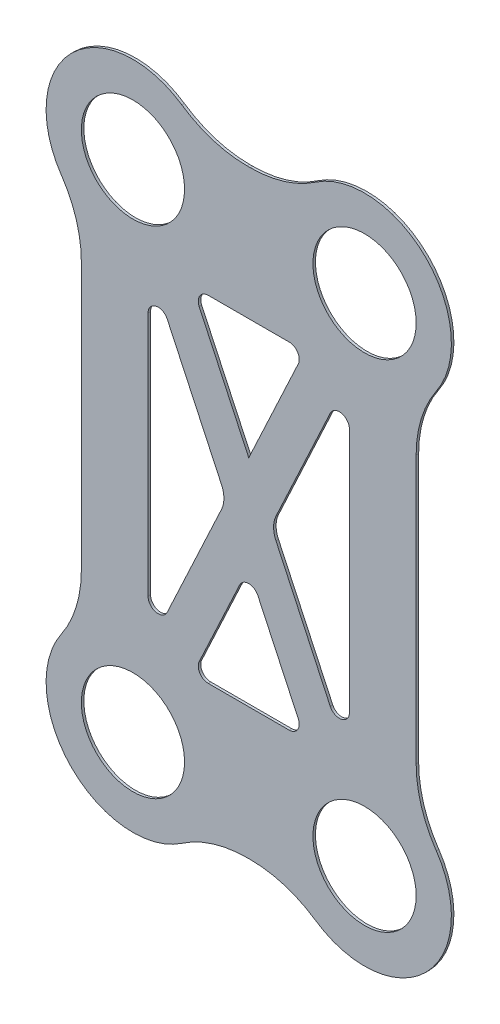
from build123d import *

# Parameters (mm, degrees)
SKETCH_1_R          = 10.25
EXTRUDE_2_DEPTH     = 0.5
FILLET_1_R          = 23
CUT_EXTRUDE_1_DEPTH = 55
FILLET_2_R          = 2
FILLET_3_R          = 5


with BuildPart() as part:
    # 草图1 → 凸台-拉伸2 (new body)
    with BuildSketch(Plane.XY):
        with BuildLine():
            ThreePointArc((-9.125563074, 59.5), (-35.197591975, 61.447591975), (-33.25, 35.375563074))
            Line((-33.25, 35.375563074), (-33.25, -35.375563074))
            ThreePointArc((-33.25, -35.375563074), (-35.197591975, -61.447591975), (-9.125563074, -59.5))
            Line((-9.125563074, -59.5), (9.125563074, -59.5))
            ThreePointArc((9.125563074, -59.5), (35.197591975, -61.447591975), (33.25, -35.375563074))
            Line((33.25, -35.375563074), (33.25, 35.375563074))
            ThreePointArc((33.25, 35.375563074), (35.197591975, 61.447591975), (9.125563074, 59.5))
            Line((9.125563074, 59.5), (-9.125563074, 59.5))
        make_face()
        with Locations((23, -49.25)):
            Circle(SKETCH_1_R, mode=Mode.SUBTRACT)
        with Locations((-23, -49.25)):
            Circle(SKETCH_1_R, mode=Mode.SUBTRACT)
        with Locations((23, 49.25)):
            Circle(SKETCH_1_R, mode=Mode.SUBTRACT)
        with Locations((-23, 49.25)):
            Circle(SKETCH_1_R, mode=Mode.SUBTRACT)
    extrude(amount=EXTRUDE_2_DEPTH)

    # 圆角1
    fillet_1_edges = [part.edges().sort_by_distance(p)[0] for p in [
        (33.25, -35.375563074, 0.25),
        (9.125563074, -59.5, 0.25),
        (-9.125563074, -59.5, 0.25),
        (-33.25, -35.375563074, 0.25),
        (-33.25, 35.375563074, 0.25),
        (-9.125563074, 59.5, 0.25),
        (9.125563074, 59.5, 0.25),
        (33.25, 35.375563074, 0.25),
    ]]
    fillet(fillet_1_edges, radius=FILLET_1_R)

    # 草图2 → 切除-拉伸1 (cut)
    with BuildSketch(Plane(origin=(0, 0, 0), x_dir=(-1, 0, 0), z_dir=(0, 0, -1))):
        Polygon((20, 33.37288914), (4.414691366, 0), (20, -33.37288914), align=None)
        Polygon((-11.170617268, 33.37288914), (0, 9.453197817), (11.170617268, 33.37288914), align=None)
        Polygon((-4.414691366, 0), (-20, 33.37288914), (-20, -33.37288914), align=None)
        Polygon((11.170617268, -33.37288914), (0, -9.453197817), (-11.170617268, -33.37288914), align=None)
    extrude(amount=-CUT_EXTRUDE_1_DEPTH, mode=Mode.SUBTRACT)

    # 圆角2
    fillet_2_edges = [part.edges().sort_by_distance(p)[0] for p in [
        (20, 33.37288914, 0.25),
        (20, -33.37288914, 0.25),
        (11.170617268, 33.37288914, 0.25),
        (-11.170617268, 33.37288914, 0.25),
        (11.170617268, -33.37288914, 0.25),
        (0, -9.453197817, 0.25),
        (-11.170617268, -33.37288914, 0.25),
        (-20, 33.37288914, 0.25),
        (-20, -33.37288914, 0.25),
    ]]
    fillet(fillet_2_edges, radius=FILLET_2_R)

    # 圆角3
    fillet_3_edges = [part.edges().sort_by_distance(p)[0] for p in [
        (4.414691366, 0, 0.25),
        (-4.414691366, 0, 0.25),
    ]]
    fillet(fillet_3_edges, radius=FILLET_3_R)


solid = part.part
